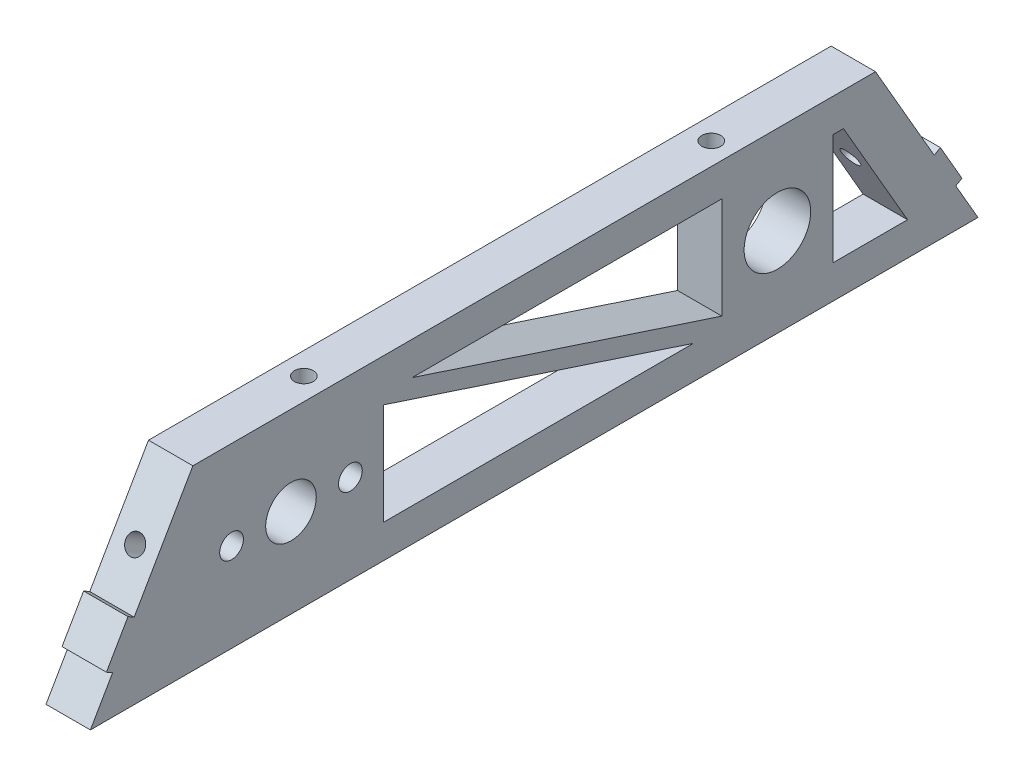
from build123d import *

# Parameters (mm, degrees)
SKETCH1_R                     = 3.6195
SKETCH1_R_2                   = 4.7625
SKETCH1_R_3                   = 1.6999966
BOSS_EXTRUDE1_DEPTH           = 6.35
TAP_DRILL_FOR_6_32_TAP4_D     = 2.7051
TAP_DRILL_FOR_6_32_TAP4_DEPTH = 10.16
TAP_DRILL_FOR_6_32_TAP4_TIP   = 0.81269403
TAP_DRILL_FOR_6_32_TAP3_D     = 2.7051
TAP_DRILL_FOR_6_32_TAP3_DEPTH = 10.16
TAP_DRILL_FOR_6_32_TAP3_TIP   = 0.81269403
SKETCH11_W                    = 6.35
SKETCH11_H                    = 6.1722
BOSS_EXTRUDE2_DEPTH           = 1.016
SKETCH12_W                    = 6.35
SKETCH12_H                    = 6.1722
BOSS_EXTRUDE3_DEPTH           = 1.016
TAP_DRILL_FOR_6_32_TAP1_D     = 2.7051
TAP_DRILL_FOR_6_32_TAP1_DEPTH = 7.62
TAP_DRILL_FOR_6_32_TAP1_TIP   = 0.81269403
TAP_DRILL_FOR_6_32_TAP2_D     = 2.7051
TAP_DRILL_FOR_6_32_TAP2_DEPTH = 7.62
TAP_DRILL_FOR_6_32_TAP2_TIP   = 0.81269403
CUT_EXTRUDE1_DEPTH            = 130.67066939


with BuildPart() as part:
    # Sketch1 → Boss-Extrude1 (new body)
    with BuildSketch(Plane(origin=(0, 0, 0), x_dir=(0, 0, -1), z_dir=(1, 0, 0))):
        Polygon((0, 0), (-14.664696837, 25.4), (-112.335303163, 25.4), (-127, 0), align=None)
        with Locations((-98.298, 12.7)):
            Circle(SKETCH1_R, mode=Mode.SUBTRACT)
        with Locations((-28.702, 12.7)):
            Circle(SKETCH1_R_2, mode=Mode.SUBTRACT)
        with Locations((-89.7979916, 12.7)):
            Circle(SKETCH1_R_3, mode=Mode.SUBTRACT)
        with Locations((-106.7980084, 12.7)):
            Circle(SKETCH1_R_3, mode=Mode.SUBTRACT)
    extrude(amount=BOSS_EXTRUDE1_DEPTH)

    # Tap Drill for #6-32 Tap4
    with Locations(Plane(origin=(0, 25.4, 0), x_dir=(1, 0, 0), z_dir=(0, 1, 0))):
        with Locations((3.175, -93.285303163), (3.175, -34.984696837)):
            Hole(TAP_DRILL_FOR_6_32_TAP4_D / 2, depth=TAP_DRILL_FOR_6_32_TAP4_DEPTH)
            with Locations((0, 0, -(TAP_DRILL_FOR_6_32_TAP4_DEPTH + TAP_DRILL_FOR_6_32_TAP4_TIP / 2))):  # 118° drill point
                Cone(0, TAP_DRILL_FOR_6_32_TAP4_D / 2, TAP_DRILL_FOR_6_32_TAP4_TIP, mode=Mode.SUBTRACT)

    # Tap Drill for #6-32 Tap3
    with Locations(Plane(origin=(0, 0, 0), x_dir=(-1, 0, 0), z_dir=(0, -1, 0))):
        with Locations((-3.175, -92.71), (-3.175, -22.86)):
            Hole(TAP_DRILL_FOR_6_32_TAP3_D / 2, depth=TAP_DRILL_FOR_6_32_TAP3_DEPTH)
            with Locations((0, 0, -(TAP_DRILL_FOR_6_32_TAP3_DEPTH + TAP_DRILL_FOR_6_32_TAP3_TIP / 2))):  # 118° drill point
                Cone(0, TAP_DRILL_FOR_6_32_TAP3_D / 2, TAP_DRILL_FOR_6_32_TAP3_TIP, mode=Mode.SUBTRACT)

    # Sketch11 → Boss-Extrude2 (add)
    with BuildSketch(Plane(origin=(0, 54.99261314, 95.25), x_dir=(1, 0, 0), z_dir=(0, 0.5000000000000038, 0.8660254037844366))):
        with Locations((3.175, -54.0639)):
            Rectangle(SKETCH11_W, SKETCH11_H)
    extrude(amount=BOSS_EXTRUDE2_DEPTH)

    # Sketch12 → Boss-Extrude3 (add)
    with BuildSketch(Plane(origin=(0, 0, 0), x_dir=(-1, 0, 0), z_dir=(0, 0.499999999999998, -0.8660254037844397))):
        with Locations((-3.175, 9.4361)):
            Rectangle(SKETCH12_W, SKETCH12_H)
    extrude(amount=BOSS_EXTRUDE3_DEPTH)

    # Tap Drill for #6-32 Tap1
    with Locations(Plane(origin=(0, 54.99261314, 95.25), x_dir=(1, 0, 0), z_dir=(0, 0.5000000000000038, 0.8660254037844366))):
        with Locations((3.175, -44.330606325)):
            Hole(TAP_DRILL_FOR_6_32_TAP1_D / 2, depth=TAP_DRILL_FOR_6_32_TAP1_DEPTH)
            with Locations((0, 0, -(TAP_DRILL_FOR_6_32_TAP1_DEPTH + TAP_DRILL_FOR_6_32_TAP1_TIP / 2))):  # 118° drill point
                Cone(0, TAP_DRILL_FOR_6_32_TAP1_D / 2, TAP_DRILL_FOR_6_32_TAP1_TIP, mode=Mode.SUBTRACT)

    # Tap Drill for #6-32 Tap2
    with Locations(Plane(origin=(0, 0, 0), x_dir=(-1, 0, 0), z_dir=(0, 0.499999999999998, -0.8660254037844397))):
        with Locations((-3.175, 19.169393675)):
            Hole(TAP_DRILL_FOR_6_32_TAP2_D / 2, depth=TAP_DRILL_FOR_6_32_TAP2_DEPTH)
            with Locations((0, 0, -(TAP_DRILL_FOR_6_32_TAP2_DEPTH + TAP_DRILL_FOR_6_32_TAP2_TIP / 2))):  # 118° drill point
                Cone(0, TAP_DRILL_FOR_6_32_TAP2_D / 2, TAP_DRILL_FOR_6_32_TAP2_TIP, mode=Mode.SUBTRACT)

    # Sketch19 → Cut-Extrude1 (cut, through all)
    with BuildSketch(Plane.ZY):
        Polygon((80.96083814, 20.6375), (36.6395, 20.6375), (36.6395, 6.099080191), align=None)
        Polygon((85.0354916, 4.7625), (85.0354916, 19.300919809), (40.71415346, 4.7625), align=None)
        Polygon((20.7645, 20.6375), (20.7645, 4.7625), (10.081979076, 4.7625), (19.247414599, 20.6375), align=None)
    extrude(amount=-CUT_EXTRUDE1_DEPTH, mode=Mode.SUBTRACT)


solid = part.part
